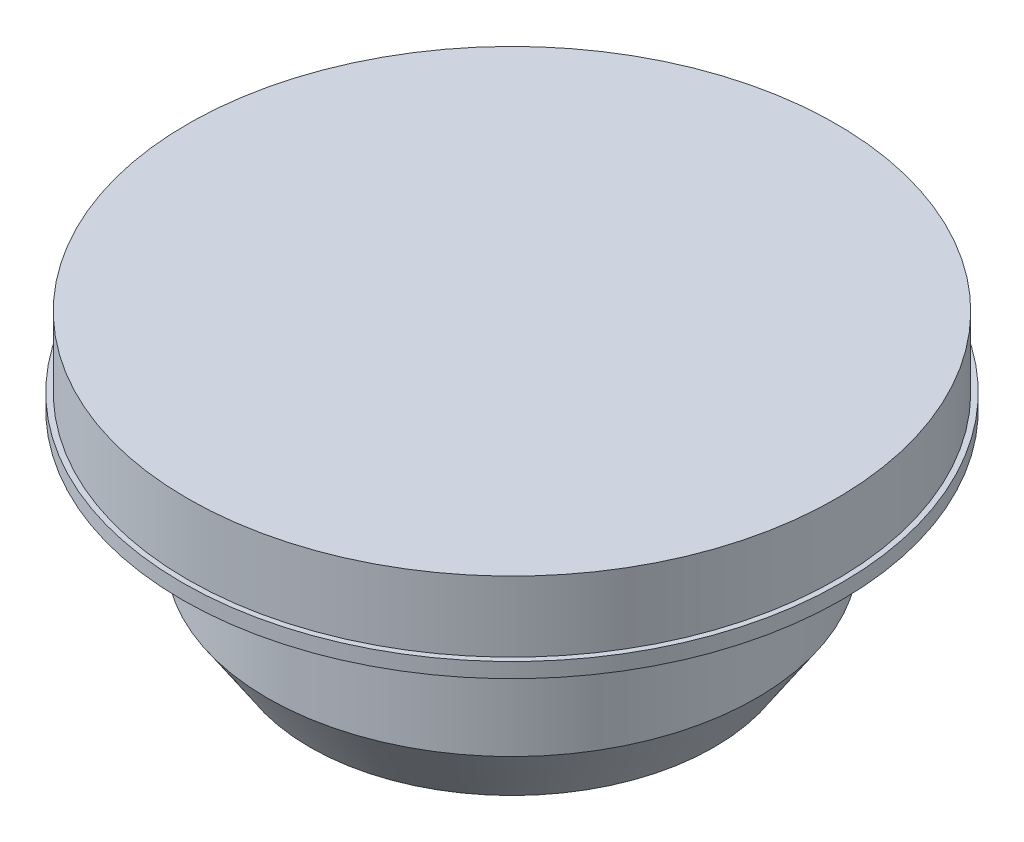
from build123d import *

# Parameters (mm, degrees)
SKETCH1_R           = 1.525
BOSS_EXTRUDE1_DEPTH = 0.4
BOSS_EXTRUDE2_START = -0.33
SKETCH3_R           = 1.55
BOSS_EXTRUDE2_DEPTH = 0.07
SKETCH4_R           = 1.15
BOSS_EXTRUDE3_DEPTH = 0.9


with BuildPart() as part:
    # Sketch1 → Boss-Extrude1 (new body)
    with BuildSketch(Plane(origin=(0, 0, 0), x_dir=(1, 0, 0), z_dir=(0, 1, 0))):
        with Locations(Location((0, 0, 0), (0, 0, 270))):
            Circle(SKETCH1_R)
    extrude(amount=BOSS_EXTRUDE1_DEPTH)

    # Sketch3 → Boss-Extrude2 (add)
    with BuildSketch(Plane(origin=(0, 0.4, 0), x_dir=(1, 0, 0), z_dir=(0, 1, 0)).offset(BOSS_EXTRUDE2_START)):
        with Locations(Location((0, 0, 0), (0, 0, 270))):
            Circle(SKETCH3_R)
    extrude(amount=-BOSS_EXTRUDE2_DEPTH)

    # Sketch4 → Boss-Extrude3 (add)
    with BuildSketch(Plane.XZ):
        with Locations(Location((0, 0, 0), (0, 0, 270))):
            Circle(SKETCH4_R)
    extrude(amount=BOSS_EXTRUDE3_DEPTH)

    # Sketch5 → Cut-Revolve1 (revolve, cut)
    with BuildSketch(Plane.XY, mode=Mode.PRIVATE) as cut_revolve1_sk:
        Polygon((-1.15, -0.6), (-0.95, -0.9), (-1.15, -0.9), align=None)
    revolve(cut_revolve1_sk.sketch.rotate(Axis((0, -0.9, 0), (0, -1, 0)), 270), axis=Axis((0, -0.9, 0), (0, -1, 0)), mode=Mode.SUBTRACT)

    # Sketch7 → Revolve1 (revolve)
    with BuildSketch(Plane.XY, mode=Mode.PRIVATE) as revolve1_sk:
        Polygon((-1.15, -0.1), (-1.25, 0), (-1.15, 0), align=None)
    revolve(revolve1_sk.sketch.rotate(Axis((0, -0.9, 0), (0, -1, 0)), 270), axis=Axis((0, -0.9, 0), (0, -1, 0)))


solid = part.part
